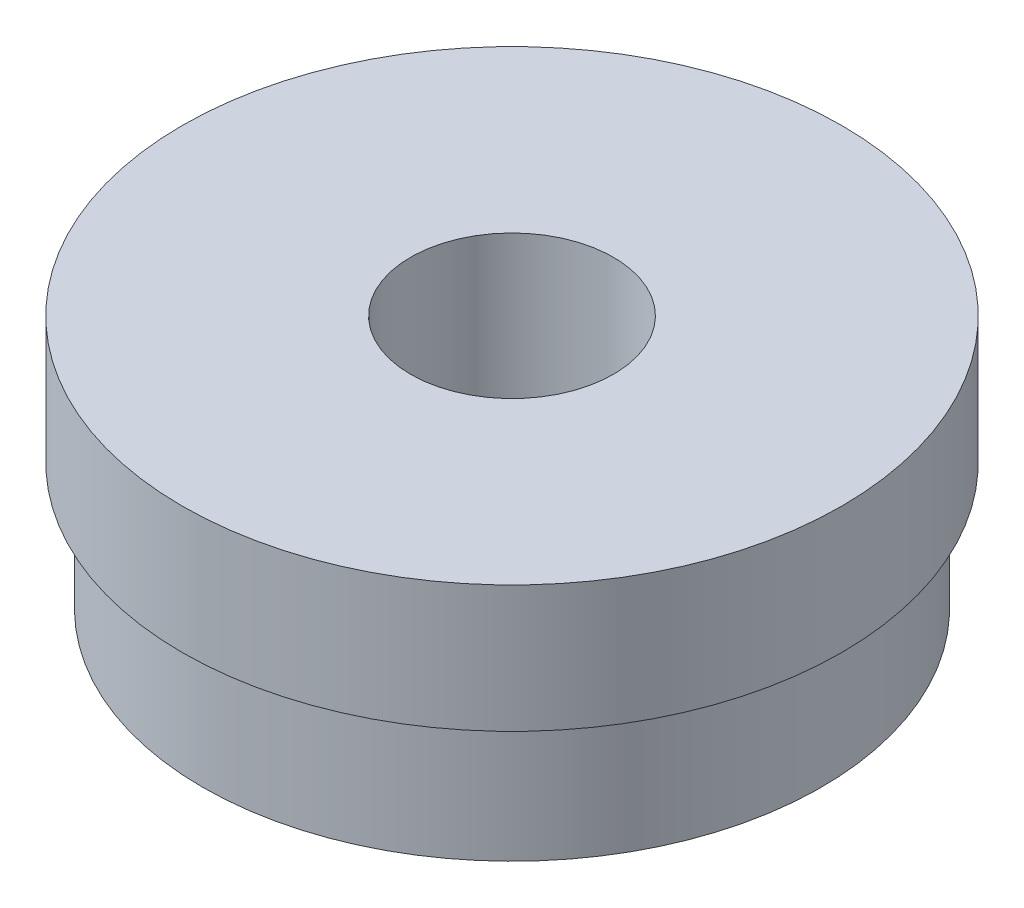
from build123d import *

# Parameters (mm, degrees)
SKETCH2_R          = 20
CUT_EXTRUDE1_DEPTH = 105.642247682


with BuildPart() as part:
    # Sketch1 → Revolve1 (revolve)
    with BuildSketch(Plane.XY, mode=Mode.PRIVATE) as revolve1_sk:
        Polygon((0, 48.053571429), (65, 48.053571429), (65, 23.053571429), (61, 23.053571429), (61, -1.946428571), (0, -1.946428571), align=None)
    revolve(revolve1_sk.sketch.rotate(Axis((0, 53.160714286, 0), (0, -1, 0)), 90), axis=Axis((0, 53.160714286, 0), (0, -1, 0)))

    # Sketch2 → Cut-Extrude1 (cut, through all)
    with BuildSketch(Plane(origin=(0, 48.053571429, 0), x_dir=(1, 0, 0), z_dir=(0, 1, 0))):
        with Locations(Location((0, 0, 0), (0, 0, 270))):
            Circle(SKETCH2_R)
    extrude(amount=-CUT_EXTRUDE1_DEPTH, mode=Mode.SUBTRACT)


solid = part.part
